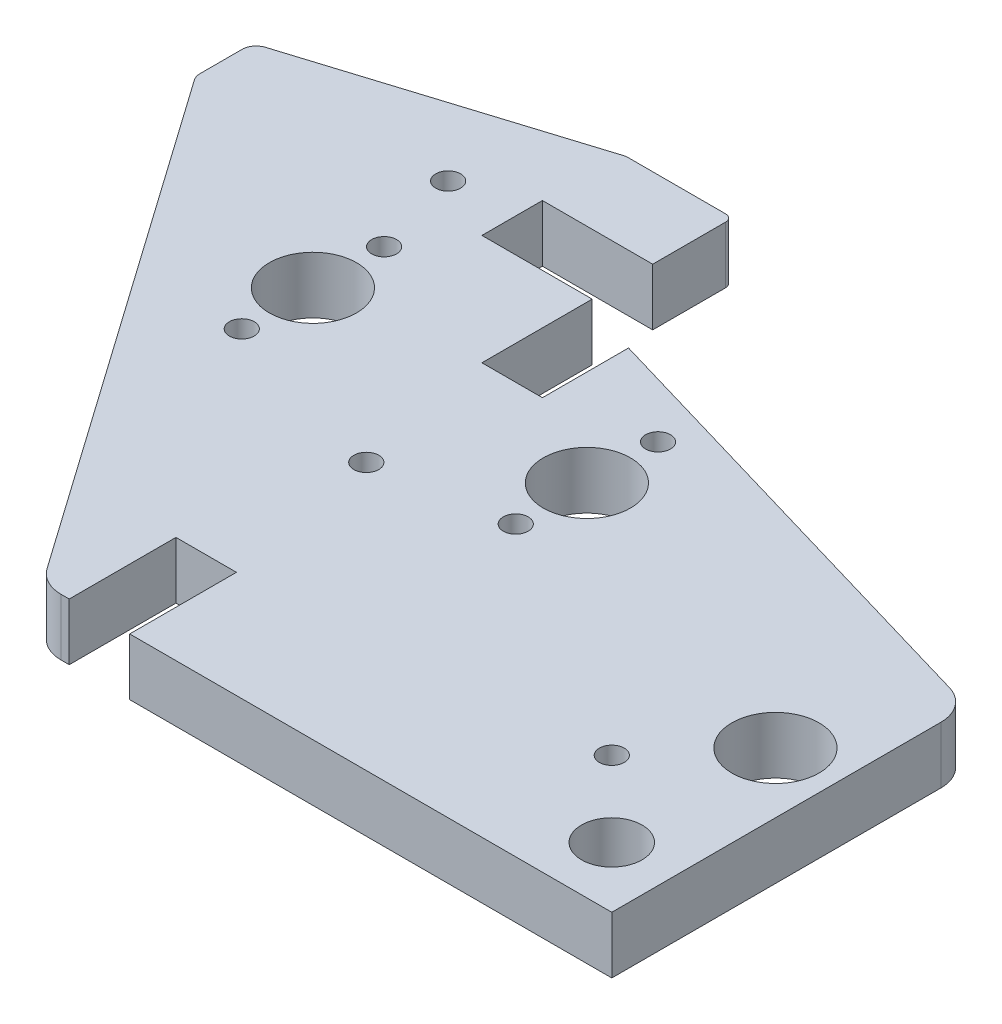
from build123d import *

# Parameters (mm, degrees)
SKETCH1_R      = 6.125
SKETCH1_R_2    = 4.25
SKETCH1_R_3    = 1.75
EXTRUDE1_DEPTH = 8
SKETCH3_W      = 8.5
SKETCH3_H      = 15
SKETCH3_W_2    = 15.5
SKETCH3_H_2    = 8.5
SKETCH3_H_3    = 15.5
EXTRUDE2_DEPTH = 10


with BuildPart() as part:
    # Sketch1 → Extrude1 (new body)
    with BuildSketch(Plane(origin=(0, 0, 0), x_dir=(1, 0, 0), z_dir=(0, 1, 0))):
        with BuildLine():
            Line((135.905429433, 28.391828159), (135.905429433, 74.65063841))
            ThreePointArc((135.905429433, 74.65063841), (134.908812883, 77.646121835), (132.316261053, 79.447465917))
            Line((132.316261053, 79.447465917), (67.905429433, 98.391828159))
            Line((67.905429433, 98.391828159), (59.905429433, 100.744769335))
            Line((59.905429433, 100.744769335), (59.905429433, 109.891828159))
            Line((59.905429433, 109.891828159), (59.905429433, 120.391828159))
            ThreePointArc((59.905429433, 120.391828159), (59.612536214, 121.09893494), (58.905429433, 121.391828159))
            Line((58.905429433, 121.391828159), (45.210651279, 121.391828159))
            ThreePointArc((45.210651279, 121.391828159), (44.908922851, 121.368937148), (44.614101292, 121.300788115))
            Line((44.614101292, 121.300788115), (6.308879447, 109.330406288))
            ThreePointArc((6.308879447, 109.330406288), (5.294048042, 108.606119288), (4.905429433, 107.421446332))
            Line((4.905429433, 107.421446332), (4.905429433, 101.524813665))
            ThreePointArc((4.905429433, 101.524813665), (4.998649565, 100.921331655), (5.269619969, 100.374106318))
            Line((5.269619969, 100.374106318), (54.411845802, 30.515059791))
            ThreePointArc((54.411845802, 30.515059791), (56.197442578, 28.954270168), (58.501369461, 28.391828159))
            Line((58.501369461, 28.391828159), (59.905429433, 28.391828159))
            Line((59.905429433, 28.391828159), (67.905429433, 28.391828159))
            Line((67.905429433, 28.391828159), (135.905429433, 28.391828159))
        make_face()
        with Locations(Location((127.405429433, 59.891828159, 0), (0, 0, 270))):
            Circle(SKETCH1_R, mode=Mode.SUBTRACT)
        with Locations(Location((127.405429433, 36.891828159, 0), (0, 0, 270))):
            Circle(SKETCH1_R_2, mode=Mode.SUBTRACT)
        with Locations(Location((116.798827433, 47.498429876, 0), (0, 0, 270))):
            Circle(SKETCH1_R_3, mode=Mode.SUBTRACT)
        with Locations(Location((81.905429433, 78.891828159, 0), (0, 0, 270))):
            Circle(SKETCH1_R, mode=Mode.SUBTRACT)
        with Locations(Location((81.905429433, 88.891828159, 0), (0, 0, 270))):
            Circle(SKETCH1_R_3, mode=Mode.SUBTRACT)
        with Locations(Location((81.905429433, 68.891828159, 0), (0, 0, 270))):
            Circle(SKETCH1_R_3, mode=Mode.SUBTRACT)
        with Locations(Location((38.905429433, 83.391828159, 0), (0, 0, 270))):
            Circle(SKETCH1_R, mode=Mode.SUBTRACT)
        with Locations(Location((38.905429433, 93.391828159, 0), (0, 0, 270))):
            Circle(SKETCH1_R_3, mode=Mode.SUBTRACT)
        with Locations(Location((38.905429433, 73.391828159, 0), (0, 0, 270))):
            Circle(SKETCH1_R_3, mode=Mode.SUBTRACT)
        with Locations(Location((35.405429433, 105.891828159, 0), (0, 0, 270))):
            Circle(SKETCH1_R_3, mode=Mode.SUBTRACT)
        with Locations(Location((63.905429433, 65.891828159, 0), (0, 0, 270))):
            Circle(SKETCH1_R_3, mode=Mode.SUBTRACT)
    extrude(amount=EXTRUDE1_DEPTH)

    # Sketch3 → Extrude2 (cut)
    with BuildSketch(Plane(origin=(0, 8, 0), x_dir=(1, 0, 0), z_dir=(0, 1, 0))):
        with Locations((63.905429433, 35.891828159)):
            Rectangle(SKETCH3_W, SKETCH3_H)
        with Locations((52.155429433, 105.891828159)):
            Rectangle(SKETCH3_W_2, SKETCH3_H_2)
        with Locations((64.155429433, 93.891828159)):
            Rectangle(SKETCH3_W, SKETCH3_H_3)
    extrude(amount=-EXTRUDE2_DEPTH, mode=Mode.SUBTRACT)


solid = part.part
